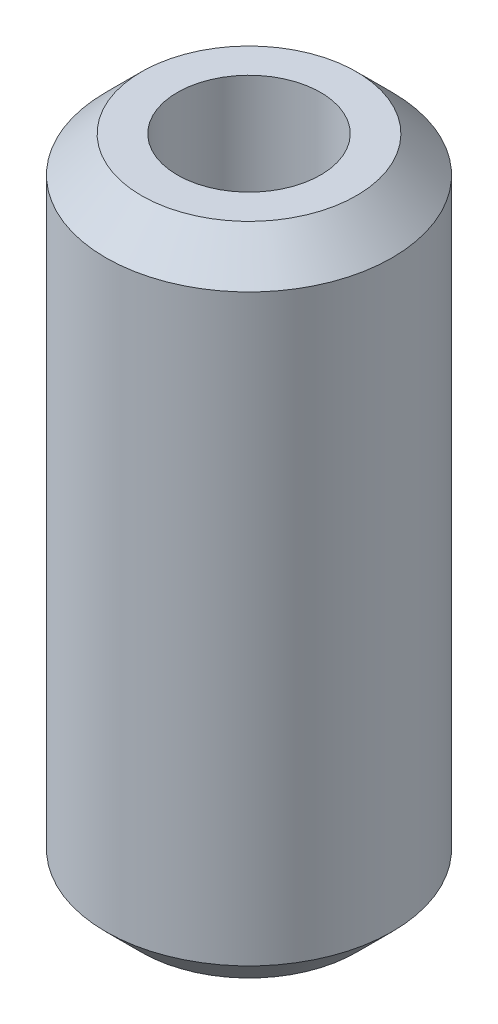
from build123d import *

# Parameters (mm, degrees)
SKETCH_1_R      = 4
SKETCH_1_R_2    = 2
EXTRUDE_1_DEPTH = 18.3
CHAMFER_1_SIZE  = 1


with BuildPart() as part:
    # Эскиз1 → Бобышка-Вытянуть1 (new body)
    with BuildSketch(Plane(origin=(0, 0, 0), x_dir=(1, 0, 0), z_dir=(0, 1, 0))):
        with Locations(Location((0, 0, 0), (0, 0, 270))):
            Circle(SKETCH_1_R)
        with Locations(Location((0, 0, 0), (0, 0, 270))):
            Circle(SKETCH_1_R_2, mode=Mode.SUBTRACT)
    extrude(amount=EXTRUDE_1_DEPTH)

    # Фаска1
    chamfer_1_edges = [part.edges().sort_by_distance(p)[0] for p in [
        (0, 0, -4),
        (0, 18.3, -4),
    ]]
    chamfer(chamfer_1_edges, length=CHAMFER_1_SIZE)


solid = part.part
